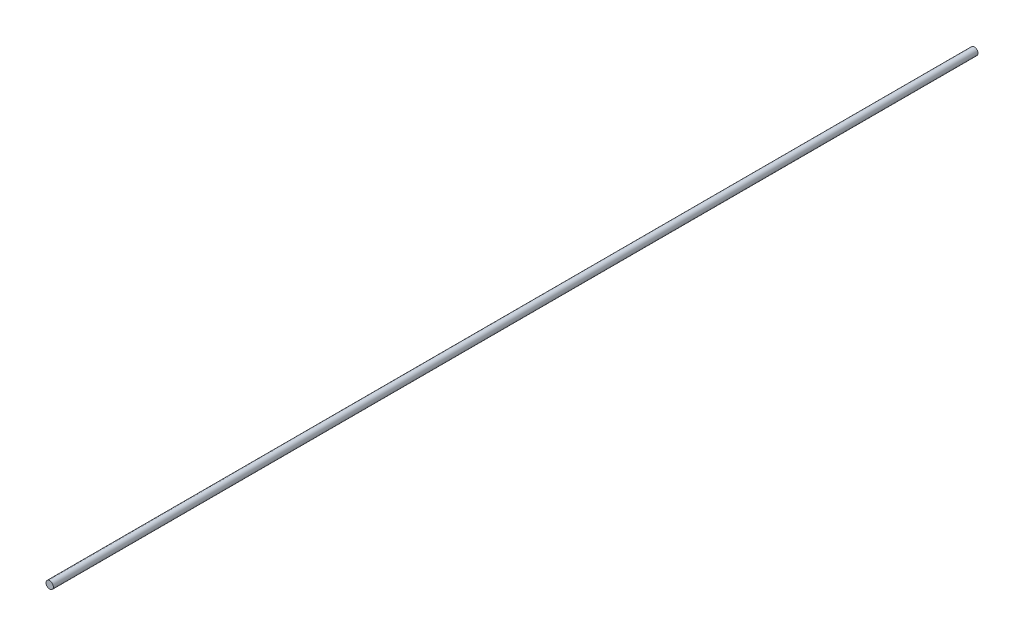
from build123d import *

# Parameters (mm, degrees)
SKETCH1_R           = 4
BOSS_EXTRUDE1_DEPTH = 1000


with BuildPart() as part:
    # Sketch1 → Boss-Extrude1 (new body)
    with BuildSketch(Plane.XY):
        Circle(SKETCH1_R)
    extrude(amount=BOSS_EXTRUDE1_DEPTH)


solid = part.part
